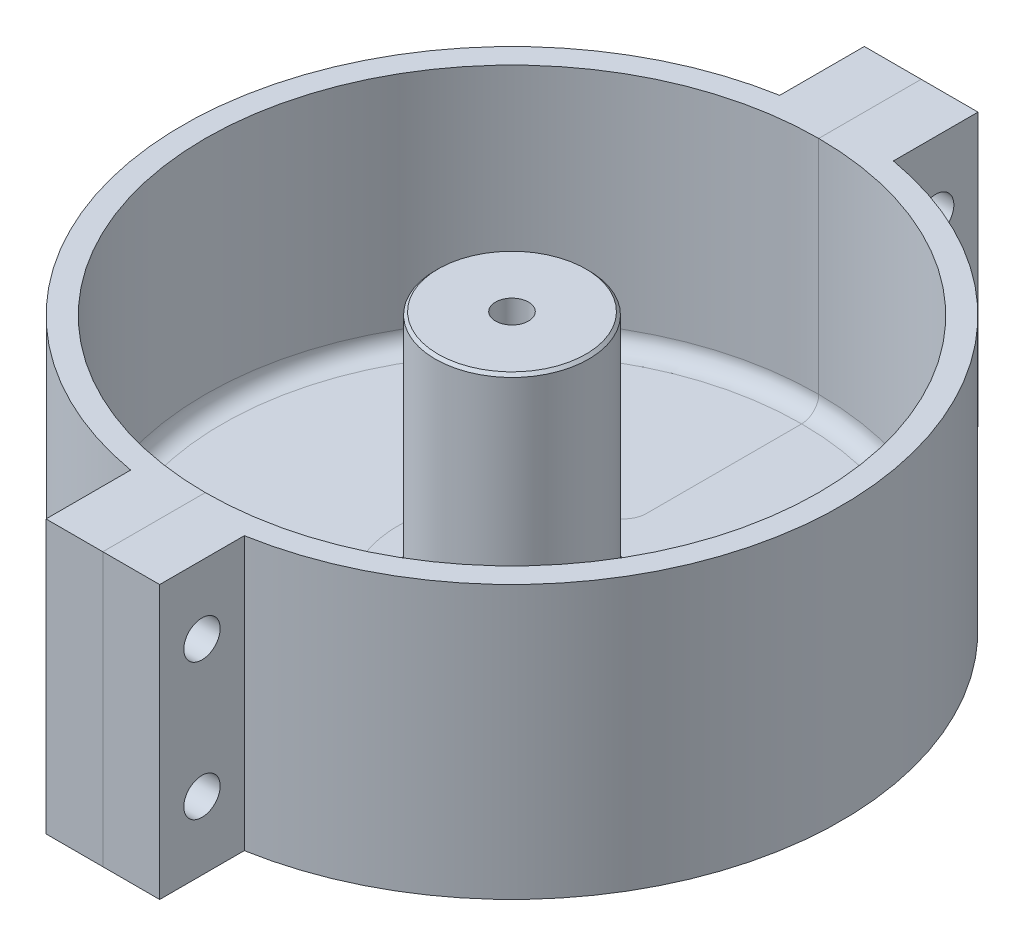
from build123d import *

# Parameters (mm, degrees)
SKETCH1_R              = 28.9875
SKETCH1_R_2            = 26.9875
BOSS_EXTRUDE1_DEPTH    = 24
SKETCH1_2_R            = 26.9875
BOSS_EXTRUDE2_DEPTH    = 3
FILLET1_R              = 1.5
SKETCH2_R              = 6.75
BOSS_EXTRUDE3_DEPTH    = 21.3
BOSS_EXTRUDE4_START    = -24
BOSS_EXTRUDE4_DEPTH    = 24
M3_CLEARANCE_HOLE1_D   = 3.2
CHAMFER1_SIZE          = 1
SPLIT1_SURFACE_1_BACK  = 96.58
SPLIT1_SURFACE_1_DEPTH = 193.16
SPLIT1_SURFACE_2_BACK  = 96.58
SPLIT1_SURFACE_2_DEPTH = 193.16
CHAMFER3_SIZE          = 0.25
SKETCH12_W             = 1.45
SKETCH12_H             = 24.3


with BuildPart() as part:
    # Sketch1 → Boss-Extrude1 (new body)
    with BuildSketch(Plane(origin=(0, 0, 0), x_dir=(1, 0, 0), z_dir=(0, 1, 0))):
        with Locations(Location((0, 0, 0), (0, 0, 270))):
            Circle(SKETCH1_R)
        with Locations(Location((0, 0, 0), (0, 0, 270))):
            Circle(SKETCH1_R_2, mode=Mode.SUBTRACT)
    extrude(amount=BOSS_EXTRUDE1_DEPTH)

    # Sketch1<2> → Boss-Extrude2 (add)
    with BuildSketch(Plane(origin=(0, 0, 0), x_dir=(1, 0, 0), z_dir=(0, 1, 0))):
        with Locations(Location((0, 0, 0), (0, 0, 270))):
            Circle(SKETCH1_2_R)
    extrude(amount=BOSS_EXTRUDE2_DEPTH)

    # Fillet1
    fillet1_edges = [part.edges().sort_by_distance(p)[0] for p in [
        (0, 3, -26.9875),
    ]]
    fillet(fillet1_edges, radius=FILLET1_R)

    # Sketch2 → Boss-Extrude3 (add)
    with BuildSketch(Plane(origin=(0, 3, 0), x_dir=(1, 0, 0), z_dir=(0, 1, 0))):
        with Locations(Location((0, 0, 0), (0, 0, 270))):
            Circle(SKETCH2_R)
    extrude(amount=BOSS_EXTRUDE3_DEPTH)

    # Sketch3 → Boss-Extrude4 (add)
    with BuildSketch(Plane(origin=(0, 24, 0), x_dir=(1, 0, 0), z_dir=(0, 1, 0)).offset(BOSS_EXTRUDE4_START)):
        with BuildLine():
            ThreePointArc((-5, 28.553023592), (-2.509420737, 28.878676628), (0, 28.9875))
            Line((0, 28.9875), (0, 36))
            Line((0, 36), (-5, 36))
            Line((-5, 36), (-5, 28.553023592))
        make_face()
        with BuildLine():
            Line((0, 36), (0, 28.9875))
            ThreePointArc((0, 28.9875), (2.509420737, 28.878676628), (5, 28.553023592))
            Line((5, 28.553023592), (5, 36))
            Line((5, 36), (0, 36))
        make_face()
    boss_extrude4 = extrude(amount=BOSS_EXTRUDE4_DEPTH)

    # M3 Clearance Hole1 (through all)
    with Locations(Plane.ZY.offset(5)):
        with Locations((-32.276511796, 18), (-32.276511796, 6)):
            m3_clearance_hole1 = Hole(M3_CLEARANCE_HOLE1_D / 2)

    # Chamfer1
    chamfer1_edges = [part.edges().sort_by_distance(p)[0] for p in [
        (0, 3, -6.75),
    ]]
    chamfer(chamfer1_edges, length=CHAMFER1_SIZE)

    # Mirror1: Boss-Extrude4, M3 Clearance Hole1 across plane
    add(boss_extrude4.mirror(Plane.XY))
    add(m3_clearance_hole1.mirror(Plane.XY), mode=Mode.SUBTRACT)


with BuildPart() as body_2:
    # Split1: the piece behind the surface
    add(part.part)
    # Split1 surface: a surface, the sketch's curves swept straight by 193.16 mm
    with BuildLine(Plane(origin=(0, 24, 0), x_dir=(1, 0, 0), z_dir=(0, 1, 0)).offset(-SPLIT1_SURFACE_1_BACK), mode=Mode.PRIVATE) as split1_surface_1_path:
        Line((0, 36), (0, 11.832159566))
        ThreePointArc((0, 11.832159566), (-0.472474768, 10.541165117), (-1.666666667, 9.860132972))
        ThreePointArc((-1.666666667, 9.860132972), (-10, 0), (-1.666666667, -9.860132972))
        ThreePointArc((-1.666666667, -9.860132972), (-0.472474768, -10.541165117), (0, -11.832159566))
        Line((0, -11.832159566), (0, -36))
    split1_surface_1 = Shell.extrude(split1_surface_1_path.wire(), (0 * SPLIT1_SURFACE_1_DEPTH, 1 * SPLIT1_SURFACE_1_DEPTH, 0 * SPLIT1_SURFACE_1_DEPTH))
    split(bisect_by=split1_surface_1, keep=Keep.BOTTOM)


with BuildPart() as part_1:
    add(part.part)

    # Split1: split by a surface, the side it looks to stays
    # Split1 surface: a surface, the sketch's curves swept straight by 193.16 mm
    with BuildLine(Plane(origin=(0, 24, 0), x_dir=(1, 0, 0), z_dir=(0, 1, 0)).offset(-SPLIT1_SURFACE_2_BACK), mode=Mode.PRIVATE) as split1_surface_2_path:
        Line((0, 36), (0, 11.832159566))
        ThreePointArc((0, 11.832159566), (-0.472474768, 10.541165117), (-1.666666667, 9.860132972))
        ThreePointArc((-1.666666667, 9.860132972), (-10, 0), (-1.666666667, -9.860132972))
        ThreePointArc((-1.666666667, -9.860132972), (-0.472474768, -10.541165117), (0, -11.832159566))
        Line((0, -11.832159566), (0, -36))
    split1_surface_2 = Shell.extrude(split1_surface_2_path.wire(), (0 * SPLIT1_SURFACE_2_DEPTH, 1 * SPLIT1_SURFACE_2_DEPTH, 0 * SPLIT1_SURFACE_2_DEPTH))
    split(bisect_by=split1_surface_2, keep=Keep.TOP)

    # Chamfer3
    chamfer3_edges = [part_1.edges().sort_by_distance(p)[0] for p in [
        (0, 24.3, -6.75),
    ]]
    chamfer(chamfer3_edges, length=CHAMFER3_SIZE)

    # Sketch12 → M3x0.5 Tapped Hole1 (revolve, cut)
    with BuildSketch(Plane(origin=(0, 24.3, 0), x_dir=(0, 0, 1), z_dir=(1, 0, 0))):
        with Locations((0.725, 12.15)):
            Rectangle(SKETCH12_W, SKETCH12_H)
    revolve(axis=Axis((0, 30.65, 0), (0, -1, 0)), mode=Mode.SUBTRACT)


solid = Compound([body_2.part, part_1.part])
